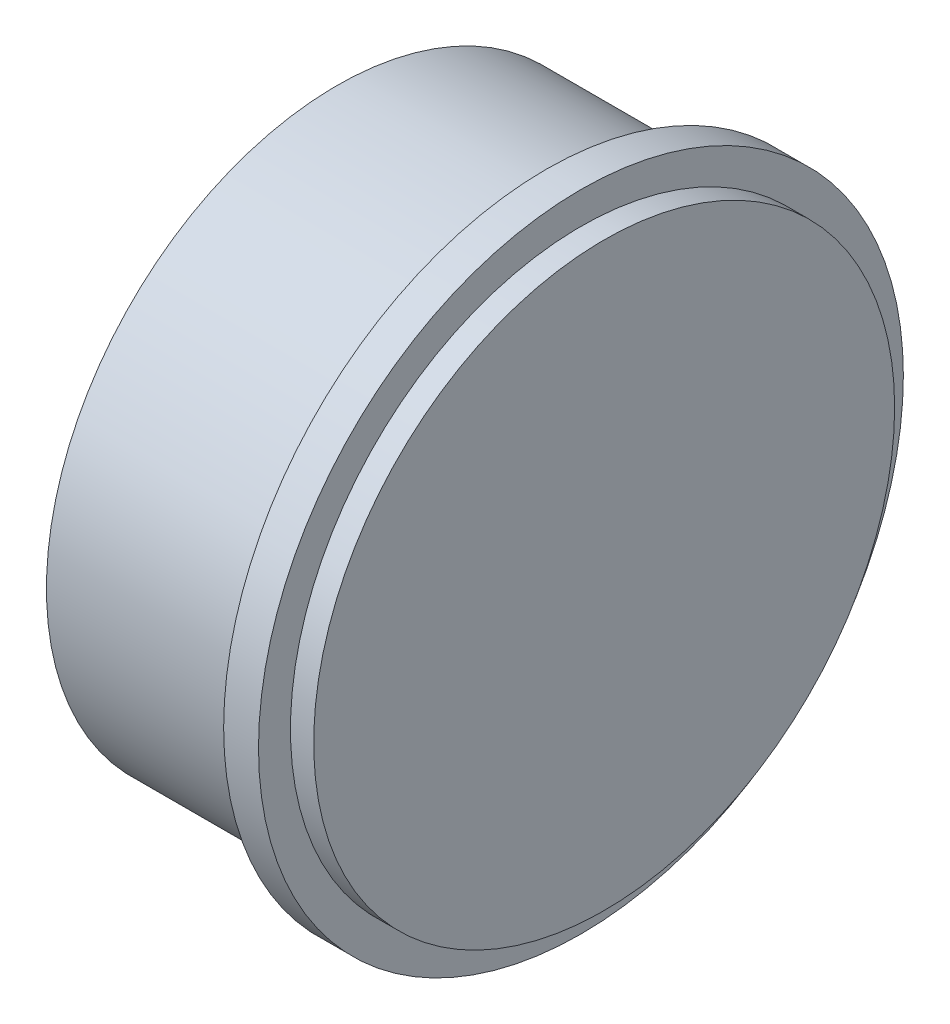
from build123d import *

# Parameters (mm, degrees)
SKETCH1_R           = 635
BOSS_EXTRUDE1_DEPTH = 457.2
SKETCH2_R           = 704.85
BOSS_EXTRUDE2_DEPTH = 76.2
SKETCH3_R           = 635
BOSS_EXTRUDE3_DEPTH = 50.8


with BuildPart() as part:
    # Sketch1 → Boss-Extrude1 (new body)
    with BuildSketch(Plane(origin=(0, 0, 0), x_dir=(0, 0, -1), z_dir=(1, 0, 0))):
        Circle(SKETCH1_R)
    extrude(amount=BOSS_EXTRUDE1_DEPTH)

    # Sketch2 → Boss-Extrude2 (add)
    with BuildSketch(Plane(origin=(457.2, 0, 0), x_dir=(0, 0, -1), z_dir=(1, 0, 0))):
        with Locations(Location((0, 0, 0), (0, 0, 180))):
            Circle(SKETCH2_R)
    extrude(amount=BOSS_EXTRUDE2_DEPTH)

    # Sketch3 → Boss-Extrude3 (add)
    with BuildSketch(Plane(origin=(533.4, 0, 0), x_dir=(0, 0, -1), z_dir=(1, 0, 0))):
        Circle(SKETCH3_R)
    extrude(amount=BOSS_EXTRUDE3_DEPTH)


solid = part.part
